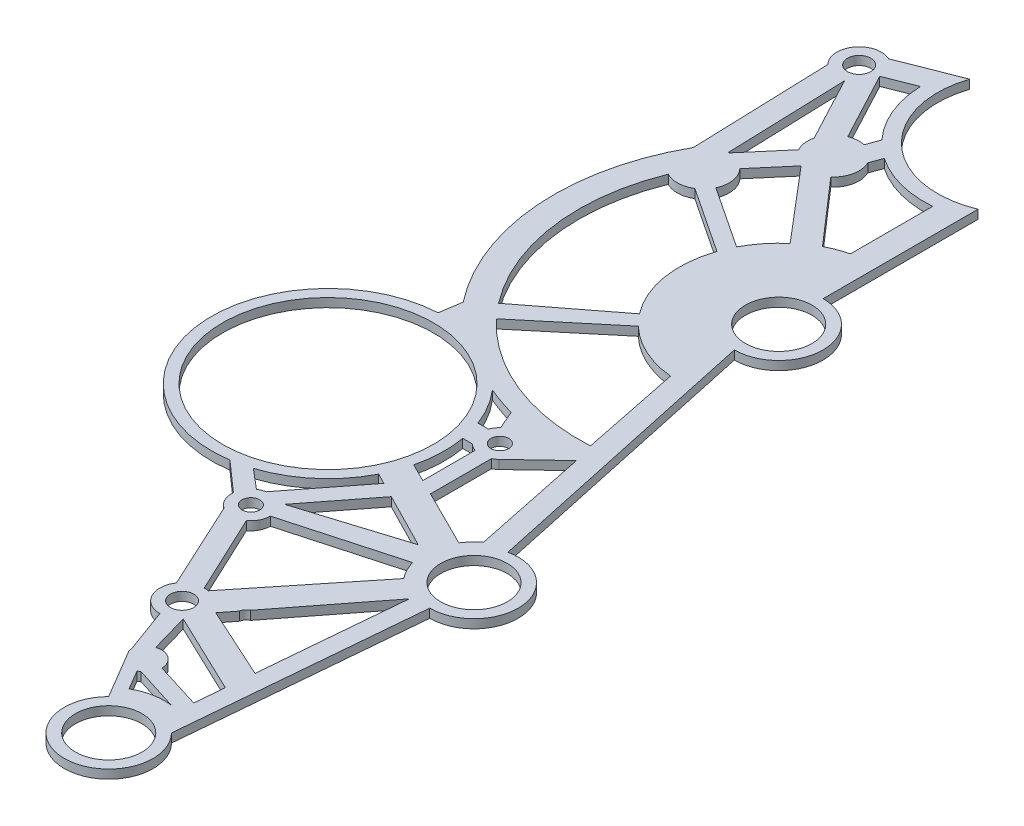
from build123d import *

# Parameters (mm, degrees)
SKETCH1_R           = 1.6
SKETCH1_R_2         = 2
SKETCH1_R_3         = 1.65
SKETCH1_R_4         = 6
BOSS_EXTRUDE2_DEPTH = 1.5875
BOSS_EXTRUDE3_START = -1.5875
BOSS_EXTRUDE3_DEPTH = 1.5875
SKETCH4_R           = 4.4
SKETCH4_R_2         = 2.1
CUT_EXTRUDE1_DEPTH  = 1.5875
BOSS_EXTRUDE4_START = -1.5875
BOSS_EXTRUDE4_DEPTH = 1.5875
SKETCH7_R           = 2.1
CUT_EXTRUDE2_DEPTH  = 1.5875
CUT_EXTRUDE3_DEPTH  = 1.5875
CUT_EXTRUDE4_DEPTH  = 1.5875
SKETCH10_R          = 4.645349595
BOSS_EXTRUDE5_DEPTH = 1.5875
CUT_EXTRUDE5_DEPTH  = 1.5875
CUT_EXTRUDE9_DEPTH  = 1.5875
SKETCH19_R          = 4
BOSS_EXTRUDE8_DEPTH = 1.5875
SKETCH20_R          = 2.1
CUT_EXTRUDE12_DEPTH = 1.5875
CUT_EXTRUDE13_START = -10
SKETCH21_R          = 15.797179748
CUT_EXTRUDE13_DEPTH = 10
SKETCH22_R          = 1.962106472
SKETCH22_R_2        = 21
BOSS_EXTRUDE9_DEPTH = 1.5875
SKETCH23_R          = 19
CUT_EXTRUDE15_DEPTH = 1.5875


with BuildPart() as part:
    # Sketch1 → Boss-Extrude2 (new body)
    with BuildSketch(Plane(origin=(0, 0, 0), x_dir=(1, 0, 0), z_dir=(0, 1, 0))):
        with BuildLine():
            Line((57.785577921, -3.804263015), (46.607089569, 48.169037391))
            ThreePointArc((46.607089569, 48.169037391), (54.607089569, 56.169037391), (46.607089569, 64.169037391))
            Line((46.607089569, 64.169037391), (46.607089569, 96.669037391))
            ThreePointArc((46.607089569, 96.669037391), (9.774896481, 73.010639225), (15.974342375, 29.675928865))
            Line((15.974342375, 29.675928865), (13.412399058, 22.705365919))
            ThreePointArc((13.412399058, 22.705365919), (-1.253243965, 6.307648563), (13.412399058, -10.090068793))
            Line((13.412399058, -10.090068793), (44.33382846, -62.316035804))
            ThreePointArc((44.33382846, -62.316035804), (50, -75.963557391), (55.66617154, -62.316035804))
            Line((55.66617154, -62.316035804), (59.462816555, -19.578912916))
            ThreePointArc((59.462816555, -19.578912916), (67.394599283, -10.759075533), (57.785577921, -3.804263015))
        make_face()
        with Locations(Location((27.233234802, -19.578912916, 0), (0, 0, 270))):
            Circle(SKETCH1_R, mode=Mode.SUBTRACT)
        with Locations(Location((44.33382846, -37.488387538, 0), (0, 0, 270))):
            Circle(SKETCH1_R, mode=Mode.SUBTRACT)
        with Locations(Location((40.089632361, 12.439739227, 0), (0, 0, 270))):
            Circle(SKETCH1_R, mode=Mode.SUBTRACT)
        with Locations(Location((13.571109585, 17.496580995, 0), (0, 0, 270))):
            Circle(SKETCH1_R_2, mode=Mode.SUBTRACT)
        with Locations(Location((26.435688468, 7.983295014, 0), (0, 0, 270))):
            Circle(SKETCH1_R_3, mode=Mode.SUBTRACT)
        with Locations(Location((4.057823603, 4.632002113, 0), (0, 0, 270))):
            Circle(SKETCH1_R_2, mode=Mode.SUBTRACT)
        with Locations(Location((16.922402486, -4.881283869, 0), (0, 0, 270))):
            Circle(SKETCH1_R_3, mode=Mode.SUBTRACT)
        with Locations(Location((46.607089569, 56.169037391, 0), (0, 0, 270))):
            Circle(SKETCH1_R_4, mode=Mode.SUBTRACT)
        with Locations(Location((59.462816555, -11.60242182, 0), (0, 0, 270))):
            Circle(SKETCH1_R_4, mode=Mode.SUBTRACT)
        with Locations(Location((50, -67.963557391, 0), (0, 0, 270))):
            Circle(SKETCH1_R_4, mode=Mode.SUBTRACT)
    extrude(amount=BOSS_EXTRUDE2_DEPTH)

    # Sketch3 → Boss-Extrude3 (add)
    with BuildSketch(Plane(origin=(0, 1.5875, 0), x_dir=(1, 0, 0), z_dir=(0, 1, 0)).offset(BOSS_EXTRUDE3_START)):
        with BuildLine():
            ThreePointArc((56.343437375, 106.672616503), (38.029280092, 122.267991205), (25.551142047, 101.702968958))
            ThreePointArc((25.551142047, 101.702968958), (27.87263843, 97.242332074), (31.478334129, 93.737252132))
            ThreePointArc((31.478334129, 93.737252132), (38.901984022, 95.929336038), (46.607089569, 96.669037391))
            Line((46.607089569, 96.669037391), (46.607089569, 92.08436081))
            ThreePointArc((46.607089569, 92.08436081), (53.685796044, 97.903157102), (56.343437375, 106.672616503))
        make_face()
        with BuildLine():
            ThreePointArc((46.607089569, 96.669037391), (38.901984022, 95.929336038), (31.478334129, 93.737252132))
            ThreePointArc((31.478334129, 93.737252132), (38.83054718, 90.968883646), (46.607089569, 92.08436081))
            Line((46.607089569, 92.08436081), (46.607089569, 96.669037391))
        make_face()
        with BuildLine():
            Line((25.551142047, 101.702968958), (23.684957519, 89.558045497))
            ThreePointArc((23.684957519, 89.558045497), (27.467237121, 91.860997946), (31.478334129, 93.737252132))
            ThreePointArc((31.478334129, 93.737252132), (27.87263843, 97.242332074), (25.551142047, 101.702968958))
        make_face()
        with BuildLine():
            Line((14.718034312, 31.202296417), (13.412399058, 22.705365919))
            Line((13.412399058, 22.705365919), (15.974342375, 29.675928865))
            ThreePointArc((15.974342375, 29.675928865), (15.33687379, 30.431446107), (14.718034312, 31.202296417))
        make_face()
    extrude(amount=BOSS_EXTRUDE3_DEPTH)

    # Sketch4 → Cut-Extrude1 (cut)
    with BuildSketch(Plane(origin=(0, 1.5875, 0), x_dir=(1, 0, 0), z_dir=(0, 1, 0))):
        with Locations(Location((40.546257627, 106.672616503, 0), (0, 0, 270))):
            Circle(SKETCH4_R)
        with Locations(Location((40.546257627, 117.14024961, 0), (0, 0, 270))):
            Circle(SKETCH4_R_2)
        with Locations(Location((30.07862452, 106.672616503, 0), (0, 0, 270))):
            Circle(SKETCH4_R_2)
        with Locations(Location((51.013890734, 106.672616503, 0), (0, 0, 270))):
            Circle(SKETCH4_R_2)
        with Locations(Location((40.546257627, 96.204983396, 0), (0, 0, 270))):
            Circle(SKETCH4_R_2)
    extrude(amount=-CUT_EXTRUDE1_DEPTH, mode=Mode.SUBTRACT)

    # Sketch5 → Boss-Extrude4 (add)
    with BuildSketch(Plane(origin=(0, 1.5875, 0), x_dir=(1, 0, 0), z_dir=(0, 1, 0)).offset(BOSS_EXTRUDE4_START)):
        with BuildLine():
            ThreePointArc((25.551142047, 101.702968958), (24.749079693, 106.66504565), (25.546385494, 111.627888844))
            Line((25.546385494, 111.627888844), (15.069905078, 107.519355049))
            ThreePointArc((15.069905078, 107.519355049), (16.746586116, 106.043341376), (17.370320575, 103.898386599))
            ThreePointArc((17.370320575, 103.898386599), (14.869777486, 100.190067711), (10.494506089, 101.118154407))
            Line((10.494506089, 101.118154407), (11.324057448, 76.05263979))
            ThreePointArc((11.324057448, 76.05263979), (16.731358953, 83.512971273), (23.684957519, 89.558045497))
            Line((23.684957519, 89.558045497), (25.551142047, 101.702968958))
        make_face()
        with BuildLine():
            ThreePointArc((17.370320575, 103.898386599), (16.746586116, 106.043341376), (15.069905078, 107.519355049))
            Line((15.069905078, 107.519355049), (10.494506089, 101.118154407))
            ThreePointArc((10.494506089, 101.118154407), (14.869777486, 100.190067711), (17.370320575, 103.898386599))
        make_face()
        with BuildLine():
            Line((10.494506089, 101.118154407), (15.069905078, 107.519355049))
            ThreePointArc((15.069905078, 107.519355049), (10.116135322, 106.224387102), (10.494506089, 101.118154407))
        make_face()
    extrude(amount=BOSS_EXTRUDE4_DEPTH)

    # Sketch7 → Cut-Extrude2 (cut)
    with BuildSketch(Plane(origin=(0, 1.5875, 0), x_dir=(1, 0, 0), z_dir=(0, 1, 0))):
        with Locations(Location((13.370320575, 103.898386599, 0), (0, 0, 270))):
            Circle(SKETCH7_R)
    extrude(amount=-CUT_EXTRUDE2_DEPTH, mode=Mode.SUBTRACT)

    # Sketch8 → Cut-Extrude3 (cut)
    with BuildSketch(Plane(origin=(0, 1.5875, 0), x_dir=(1, 0, 0), z_dir=(0, 1, 0))):
        with BuildLine():
            Line((22.270838211, 106.046731613), (17.003966644, 103.98123643))
            Line((17.003966644, 103.98123643), (25.133879781, 88.688315663))
            Line((25.133879781, 88.688315663), (27.134869461, 94.242115541))
            ThreePointArc((27.134869461, 94.242115541), (23.639138303, 99.70612507), (22.270838211, 106.046731613))
        make_face()
        with BuildLine():
            Line((23.303910604, 83.609187721), (14.529941424, 100.113621806))
            Line((14.529941424, 100.113621806), (15.247017929, 78.446619001))
            ThreePointArc((15.247017929, 78.446619001), (19.293244571, 76.357661165), (19.633932022, 71.816777227))
            Line((19.633932022, 71.816777227), (30.737973308, 64.447240272))
            ThreePointArc((30.737973308, 64.447240272), (32.619982891, 67.336773985), (35.021180558, 69.811771949))
            Line((35.021180558, 69.811771949), (23.303910604, 83.609187721))
        make_face()
        with BuildLine():
            ThreePointArc((17.853338423, 69.811771949), (15.561587714, 69.11846853), (13.227665034, 69.65288023))
            ThreePointArc((13.227665034, 69.65288023), (10.939961924, 51.284776385), (18.081503164, 34.207914463))
            Line((18.081503164, 34.207914463), (32.424696296, 45.250373787))
            ThreePointArc((32.424696296, 45.250373787), (28.946124471, 53.262526481), (29.673617088, 61.966882128))
            Line((29.673617088, 61.966882128), (17.853338423, 69.811771949))
        make_face()
    extrude(amount=-CUT_EXTRUDE3_DEPTH, mode=Mode.SUBTRACT)

    # Sketch9 → Cut-Extrude4 (cut)
    with BuildSketch(Plane(origin=(0, 1.5875, 0), x_dir=(1, 0, 0), z_dir=(0, 1, 0))):
        with BuildLine():
            ThreePointArc((42.074546437, 88.450459111), (35.884397618, 88.990711969), (30.232534907, 91.572622783))
            Line((30.232534907, 91.572622783), (29.429468095, 89.400967731))
            ThreePointArc((29.429468095, 89.400967731), (29.783097277, 88.406341356), (29.90303822, 87.357556633))
            ThreePointArc((29.90303822, 87.357556633), (29.485817932, 85.43344764), (28.309102029, 83.854964865))
            Line((28.309102029, 83.854964865), (38.418011185, 72.251364401))
            ThreePointArc((38.418011185, 72.251364401), (40.208614988, 73.043923164), (42.074546437, 73.637818103))
            Line((42.074546437, 73.637818103), (42.074546437, 88.450459111))
        make_face()
    extrude(amount=-CUT_EXTRUDE4_DEPTH, mode=Mode.SUBTRACT)

    # Sketch10 → Boss-Extrude5 (add)
    with BuildSketch(Plane(origin=(0, 1.5875, 0), x_dir=(1, 0, 0), z_dir=(0, 1, 0))):
        with BuildLine():
            Line((21.149022647, 85.190038065), (15.401380278, 78.449172638))
            Line((15.401380278, 78.449172638), (18.822645862, 76.956289361))
            Line((18.822645862, 76.956289361), (23.902708068, 82.914213235))
            ThreePointArc((23.902708068, 82.914213235), (22.29834697, 83.776834662), (21.149022647, 85.190038065))
        make_face()
        with Locations((25.257688625, 87.357556633)):
            Circle(SKETCH10_R)
    extrude(amount=-BOSS_EXTRUDE5_DEPTH)

    # Sketch11 → Cut-Extrude5 (cut)
    with BuildSketch(Plane(origin=(0, 1.5875, 0), x_dir=(1, 0, 0), z_dir=(0, 1, 0))):
        with BuildLine():
            ThreePointArc((44.938100904, 38.348488279), (39.181474054, 39.883530704), (34.247593759, 43.222981731))
            Line((34.247593759, 43.222981731), (20.307532747, 31.585845755))
            ThreePointArc((20.307532747, 31.585845755), (33.204031538, 22.757092889), (48.626702285, 20.225732528))
            Line((48.626702285, 20.225732528), (44.938100904, 38.348488279))
        make_face()
        with BuildLine():
            ThreePointArc((36.26030403, 18.303590576), (27.416947578, 21.925987237), (19.710998912, 27.57798388))
            Line((19.710998912, 27.57798388), (18.938710266, 22.389298788))
            ThreePointArc((18.938710266, 22.389298788), (25.46420767, 19.263484394), (30.024920763, 13.646302887))
            Line((30.024920763, 13.646302887), (36.804178947, 13.646302887))
            ThreePointArc((36.804178947, 13.646302887), (37.166998848, 14.365411409), (37.684600309, 14.982537063))
            Line((37.684600309, 14.982537063), (36.26030403, 18.303590576))
        make_face()
        with BuildLine():
            Line((23.748837452, -19.248799138), (13.412399058, -10.090068793))
            Line((13.412399058, -10.090068793), (32.107751545, -41.666321285))
            ThreePointArc((32.107751545, -41.666321285), (32.068874877, -40.005058031), (32.708438415, -38.471348322))
            Line((32.708438415, -38.471348322), (25.310969778, -22.503788499))
            ThreePointArc((25.310969778, -22.503788499), (24.077804809, -21.093264776), (23.748837452, -19.248799138))
        make_face()
        with BuildLine():
            Line((37.684600309, 9.896941391), (31.351630359, 9.896941391))
            ThreePointArc((31.351630359, 9.896941391), (31.742887661, 6.664917922), (31.491928413, 3.418985476))
            Line((31.491928413, 3.418985476), (38.929266279, -0.294255815))
            Line((38.929266279, -0.294255815), (38.929266279, 9.137686751))
            ThreePointArc((38.929266279, 9.137686751), (38.266960458, 9.451785557), (37.684600309, 9.896941391))
        make_face()
        with BuildLine():
            ThreePointArc((29.936377952, -1.206671629), (24.790621379, -7.152092679), (17.477492698, -10.040862499))
            Line((17.477492698, -10.040862499), (25.310969778, -16.654037333))
            ThreePointArc((25.310969778, -16.654037333), (25.917615868, -16.335589494), (26.574677388, -16.14142806))
            Line((26.574677388, -16.14142806), (35.856851812, -4.235227198))
            Line((35.856851812, -4.235227198), (29.936377952, -1.206671629))
        make_face()
        with BuildLine():
            ThreePointArc((36, -44.74414887), (34.564180779, -44.477568638), (33.319742068, -43.713360451))
            Line((33.319742068, -43.713360451), (38.988258823, -53.287425259))
            ThreePointArc((38.988258823, -53.287425259), (38.982277864, -53.110729221), (38.987264085, -52.934002315))
            Line((38.987264085, -52.934002315), (36, -44.74414887))
        make_face()
        with BuildLine():
            Line((49.652635334, 16.6671019), (42.494664412, 9.896941391))
            ThreePointArc((42.494664412, 9.896941391), (42.113801435, 9.58443897), (41.69283275, 9.328509806))
            Line((41.69283275, 9.328509806), (41.69283275, -1.674022247))
            Line((41.69283275, -1.674022247), (51.893737087, -6.76702997))
            ThreePointArc((51.893737087, -6.76702997), (52.859204313, -5.514377495), (54.029419034, -4.450487136))
            Line((54.029419034, -4.450487136), (49.652635334, 16.6671019))
        make_face()
        with BuildLine():
            ThreePointArc((30.733234802, -19.578912916), (30.347372441, -21.176456895), (29.274865223, -22.421753964))
            Line((29.274865223, -22.421753964), (36, -36.74414887))
            ThreePointArc((36, -36.74414887), (36.404157783, -36.764619188), (36.804178947, -36.825820626))
            Line((36.804178947, -36.825820626), (52.50945718, -17.287733752))
            ThreePointArc((52.50945718, -17.287733752), (51.488220715, -15.734951255), (50.808425135, -14.005230072))
            Line((50.808425135, -14.005230072), (30.733234802, -19.578912916))
        make_face()
        with BuildLine():
            Line((53.46362734, -50.406848658), (38.929266279, -43.468006257))
            Line((38.929266279, -43.468006257), (40.907560182, -50.406848658))
            ThreePointArc((40.907560182, -50.406848658), (43.470698918, -50.770628666), (44.682047755, -53.058564433))
            Line((44.682047755, -53.058564433), (52.998564734, -55.641373157))
            Line((52.998564734, -55.641373157), (53.46362734, -50.406848658))
        make_face()
        Polygon((48.53670869, -10.721473414), (38.603269126, -5.640127828), (30.179720323, -16.453526736), align=None)
        with BuildLine():
            ThreePointArc((43.380170812, -55.495829677), (43.141144188, -55.634475907), (42.889814418, -55.749322982))
            Line((42.889814418, -55.749322982), (44.97511935, -59.271380942))
            ThreePointArc((44.97511935, -59.271380942), (48.033331446, -58.11797098), (51.299968657, -58.007984155))
            Line((51.299968657, -58.007984155), (43.380170812, -55.495829677))
        make_face()
        Polygon((53.899807967, -45.497406051), (56.16883109, -19.958356125), (40.907560182, -39.577437576), align=None)
    extrude(amount=-CUT_EXTRUDE5_DEPTH, mode=Mode.SUBTRACT)

    # Sketch13 → Cut-Extrude9 (cut)
    with BuildSketch(Plane(origin=(0, 1.5875, 0), x_dir=(1, 0, 0), z_dir=(0, 1, 0))):
        with BuildLine():
            ThreePointArc((32.281400747, -39.270371546), (32.010464376, -40.455002704), (32.107751545, -41.666321285))
            Line((32.107751545, -41.666321285), (33.319742068, -43.713360451))
            ThreePointArc((33.319742068, -43.713360451), (33.86679158, -44.127848301), (34.476645862, -44.442715101))
            Line((34.476645862, -44.442715101), (32.281400747, -39.270371546))
        make_face()
    extrude(amount=-CUT_EXTRUDE9_DEPTH, mode=Mode.SUBTRACT)

    # Sketch19 → Boss-Extrude8 (add)
    with BuildSketch(Plane(origin=(0, 1.5875, 0), x_dir=(1, 0, 0), z_dir=(0, 1, 0))):
        with Locations((36, -40.74414887)):
            Circle(SKETCH19_R)
    extrude(amount=-BOSS_EXTRUDE8_DEPTH)

    # Sketch20 → Cut-Extrude12 (cut)
    with BuildSketch(Plane(origin=(0, 1.5875, 0), x_dir=(1, 0, 0), z_dir=(0, 1, 0))):
        with Locations(Location((36, -40.74414887, 0), (0, 0, 270))):
            Circle(SKETCH20_R)
    extrude(amount=-CUT_EXTRUDE12_DEPTH, mode=Mode.SUBTRACT)

    # Sketch21 → Cut-Extrude13 (cut)
    with BuildSketch(Plane(origin=(0, 1.5875, 0), x_dir=(1, 0, 0), z_dir=(0, 1, 0)).offset(CUT_EXTRUDE13_START)):
        with Locations((40.546257627, 106.672616503)):
            Circle(SKETCH21_R)
    extrude(amount=CUT_EXTRUDE13_DEPTH, mode=Mode.SUBTRACT)

    # Sketch22 → Boss-Extrude9 (add)
    with BuildSketch(Plane(origin=(0, 1.5875, 0), x_dir=(1, 0, 0), z_dir=(0, 1, 0))):
        with Locations((19.710998912, 27.57798388)):
            Circle(SKETCH22_R)
        with Locations((15.246756035, 6.307648563)):
            Circle(SKETCH22_R_2)
    extrude(amount=-BOSS_EXTRUDE9_DEPTH)

    # Sketch23 → Cut-Extrude15 (cut)
    with BuildSketch(Plane(origin=(0, 1.5875, 0), x_dir=(1, 0, 0), z_dir=(0, 1, 0))):
        with Locations(Location((15.246756035, 6.307648563, 0), (0, 0, 270))):
            Circle(SKETCH23_R)
    extrude(amount=-CUT_EXTRUDE15_DEPTH, mode=Mode.SUBTRACT)


solid = part.part
